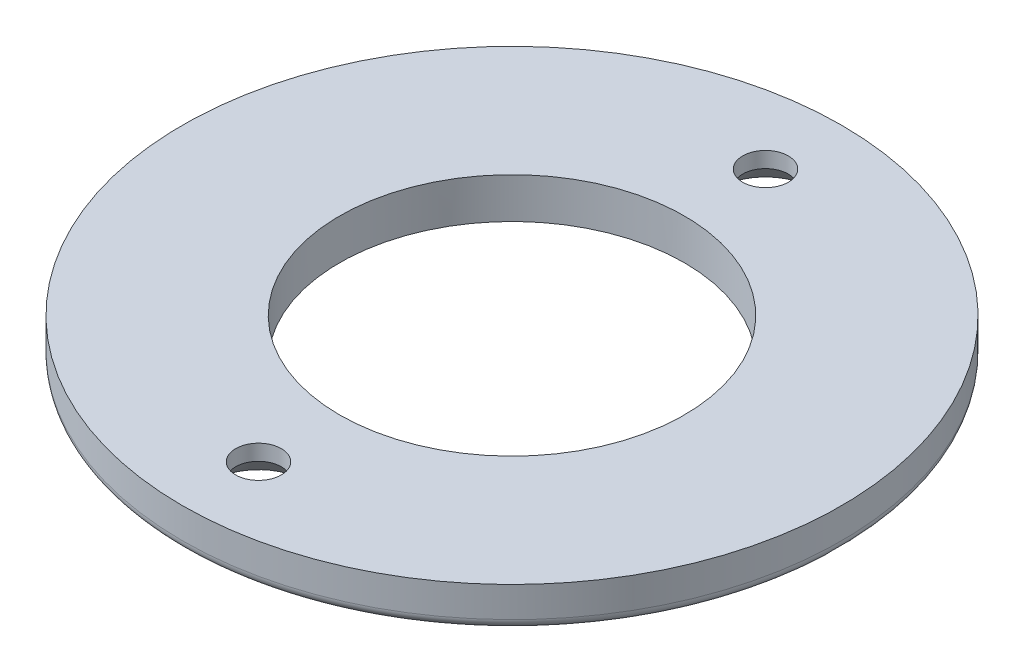
from build123d import *

# Parameters (mm, degrees)
CSK_SLOT_FOR_M4_COUNTERSUNK_FLAT_HEA_2_COUNT = 2
CSK_SLOT_FOR_M4_COUNTERSUNK_FLAT_HEA_2_PITCH = 50
FILLET1_R                                    = 1
CUT_EXTRUDE2_START                           = -10
SKETCH5_R                                    = 17
CUT_EXTRUDE2_DEPTH                           = 10


with BuildPart() as part:
    # Sketch1 → Revolve1 (revolve)
    with BuildSketch(Plane.XY, mode=Mode.PRIVATE) as revolve1_sk:
        Polygon((-32.5, 0), (-32.5, 4), (-17, 4), (-17, 2), (0, 2), (0, 0), align=None)
    revolve(revolve1_sk.sketch.rotate(Axis((0, 0, 0), (0, -1, 0)), 270), axis=Axis((0, 0, 0), (0, -1, 0)))

    # Sketch3 → CSK SLOT for M4 Countersunk Flat Head Screw1 (revolve, cut)
    with BuildSketch(Plane(origin=(0, 0, 25), x_dir=(0, 0, -1), z_dir=(1, 0, 0))):
        Polygon((0, 0), (0, 4), (2.25, 4), (2.25, 2.45), (4.7, 0), align=None)
    csk_slot_for_m4_countersunk_flat_head_sc = revolve(axis=Axis((0, -6.35, 25), (0, 1, 0)), mode=Mode.SUBTRACT)

    # CSK SLOT for M4 Countersunk Flat Hea 2: CSK SLOT for M4 Countersunk Flat Head Screw1 ×2
    with Locations(*[(0, 0, -i * CSK_SLOT_FOR_M4_COUNTERSUNK_FLAT_HEA_2_PITCH) for i in range(1, CSK_SLOT_FOR_M4_COUNTERSUNK_FLAT_HEA_2_COUNT)]):
        add(csk_slot_for_m4_countersunk_flat_head_sc, mode=Mode.SUBTRACT)

    # Fillet1
    fillet1_edges = [part.edges().sort_by_distance(p)[0] for p in [
        (0, 2, -17),
        (0, 0, -32.5),
    ]]
    fillet(fillet1_edges, radius=FILLET1_R)

    # Sketch5 → Cut-Extrude2 (cut)
    with BuildSketch(Plane(origin=(0, 4, 0), x_dir=(1, 0, 0), z_dir=(0, 1, 0)).offset(CUT_EXTRUDE2_START)):
        with Locations(Location((0, 0, 0), (0, 0, 270))):
            Circle(SKETCH5_R)
    extrude(amount=CUT_EXTRUDE2_DEPTH, mode=Mode.SUBTRACT)


solid = part.part
